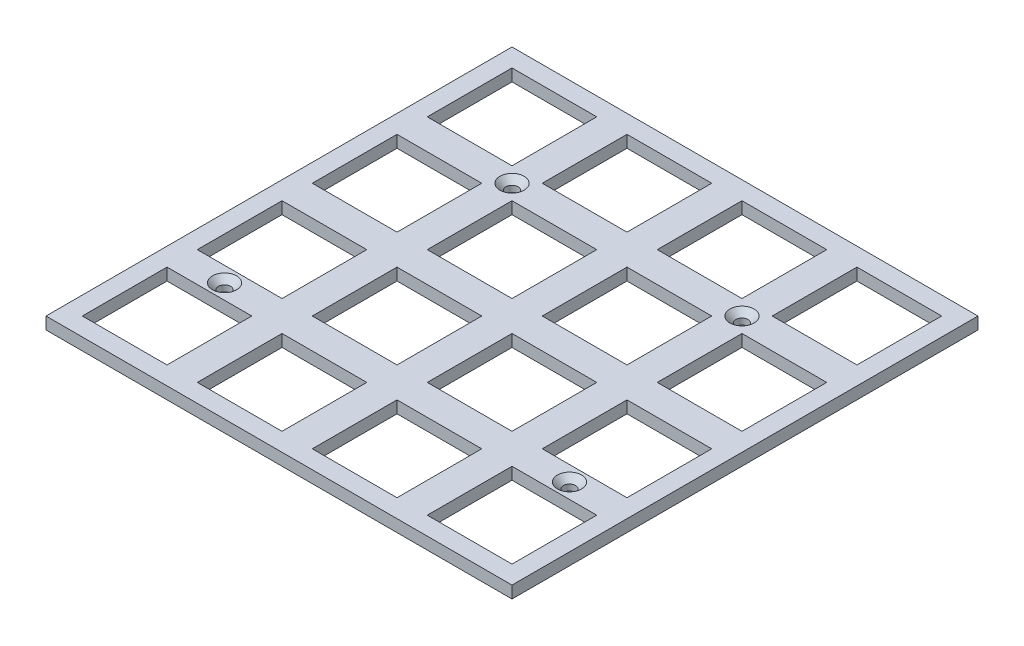
from build123d import *

# Parameters (mm, degrees)
SKETCH1_W                = 77
SKETCH1_H                = 77
SKETCH1_W_2              = 14
SKETCH1_H_2              = 14
BOSS_EXTRUDE1_DEPTH      = 2
SKETCH2_R                = 1
CUT_EXTRUDE1_DEPTH       = 2
CHAMFER1_SIZE            = 1
CHAMFER1_OF_MIRROR1_SIZE = 1


with BuildPart() as part:
    # Sketch1 → Boss-Extrude1 (new body)
    with BuildSketch(Plane(origin=(0, 0, 0), x_dir=(1, 0, 0), z_dir=(0, 1, 0))):
        Rectangle(SKETCH1_W, SKETCH1_H)
        with Locations((-9.5, 28.5)):
            Rectangle(SKETCH1_W_2, SKETCH1_H_2, mode=Mode.SUBTRACT)
        with Locations((-28.5, 28.5)):
            Rectangle(SKETCH1_W_2, SKETCH1_H_2, mode=Mode.SUBTRACT)
        with Locations((9.5, 28.5)):
            Rectangle(SKETCH1_W_2, SKETCH1_H_2, mode=Mode.SUBTRACT)
        with Locations((28.5, 28.5)):
            Rectangle(SKETCH1_W_2, SKETCH1_H_2, mode=Mode.SUBTRACT)
        with Locations((-9.5, 9.5)):
            Rectangle(SKETCH1_W_2, SKETCH1_H_2, mode=Mode.SUBTRACT)
        with Locations((9.5, 9.5)):
            Rectangle(SKETCH1_W_2, SKETCH1_H_2, mode=Mode.SUBTRACT)
        with Locations((28.5, 9.5)):
            Rectangle(SKETCH1_W_2, SKETCH1_H_2, mode=Mode.SUBTRACT)
        with Locations((-9.5, -9.5)):
            Rectangle(SKETCH1_W_2, SKETCH1_H_2, mode=Mode.SUBTRACT)
        with Locations((9.5, -9.5)):
            Rectangle(SKETCH1_W_2, SKETCH1_H_2, mode=Mode.SUBTRACT)
        with Locations((28.5, -9.5)):
            Rectangle(SKETCH1_W_2, SKETCH1_H_2, mode=Mode.SUBTRACT)
        with Locations((-9.5, -28.5)):
            Rectangle(SKETCH1_W_2, SKETCH1_H_2, mode=Mode.SUBTRACT)
        with Locations((9.5, -28.5)):
            Rectangle(SKETCH1_W_2, SKETCH1_H_2, mode=Mode.SUBTRACT)
        with Locations((28.5, -28.5)):
            Rectangle(SKETCH1_W_2, SKETCH1_H_2, mode=Mode.SUBTRACT)
        with Locations((-28.5, 9.5)):
            Rectangle(SKETCH1_W_2, SKETCH1_H_2, mode=Mode.SUBTRACT)
        with Locations((-28.5, -9.5)):
            Rectangle(SKETCH1_W_2, SKETCH1_H_2, mode=Mode.SUBTRACT)
        with Locations((-28.5, -28.5)):
            Rectangle(SKETCH1_W_2, SKETCH1_H_2, mode=Mode.SUBTRACT)
    extrude(amount=BOSS_EXTRUDE1_DEPTH)

    # Sketch2 → Cut-Extrude1 (cut)
    with BuildSketch(Plane(origin=(0, 2, 0), x_dir=(1, 0, 0), z_dir=(0, 1, 0))):
        with Locations(Location((-19, 19, 0), (0, 0, 270))):
            Circle(SKETCH2_R)
        with Locations(Location((-28.5, -19, 0), (0, 0, 270))):
            Circle(SKETCH2_R)
    cut_extrude1 = extrude(amount=-CUT_EXTRUDE1_DEPTH, mode=Mode.SUBTRACT)

    # Chamfer1
    chamfer1_edges = [part.edges().sort_by_distance(p)[0] for p in [
        (-19, 2, -20),
        (-28.5, 2, 18),
    ]]
    chamfer(chamfer1_edges, length=CHAMFER1_SIZE)

    # Mirror1: Cut-Extrude1 across plane
    add(cut_extrude1.mirror(Plane(origin=(0, 0, 0), x_dir=(0, 0, 1), z_dir=(1, 0, 0))), mode=Mode.SUBTRACT)

    # Chamfer1 of Mirror1
    chamfer1_of_mirror1_edges = [part.edges().sort_by_distance(p)[0] for p in [
        (19, 2, -20),
        (28.5, 2, 18),
    ]]
    chamfer(chamfer1_of_mirror1_edges, length=CHAMFER1_OF_MIRROR1_SIZE)


solid = part.part
